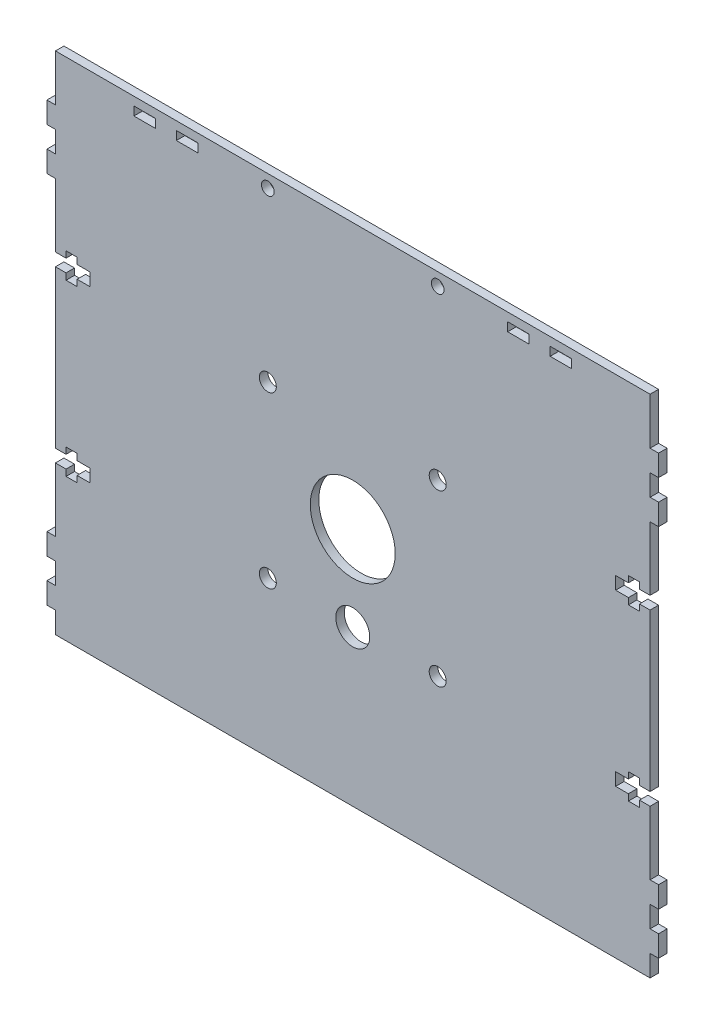
from build123d import *

# Parameters (mm, degrees)
SKETCH_1_R      = 10
SKETCH_1_R_2    = 4
SKETCH_1_R_3    = 1.5
SKETCH_1_R_4    = 2
SKETCH_1_W      = 5.05
SKETCH_1_H      = 2.05
EXTRUDE_1_DEPTH = 2


with BuildPart() as part:
    # 草图1 → 凸台-拉伸1 (new body)
    with BuildSketch(Plane.XY):
        Polygon((317.453360513, 257.462931603), (317.453360513, 258.962931602), (314.853360513, 258.962931602), (314.853360513, 257.462931603), (311.853360513, 257.462931603), (311.853360513, 254.462931603), (314.853360513, 254.462931603), (314.853360513, 252.962931603), (317.453360513, 252.962931603), (317.453360513, 254.462931603), (319.953360513, 254.462931603), (319.953360513, 239.462931603), (321.953360513, 239.462931603), (321.953360513, 234.462931603), (319.953360513, 234.462931603), (319.953360513, 229.462931603), (321.953360513, 229.462931603), (321.953360513, 224.462931603), (319.953360513, 224.462931603), (319.953360513, 219.440879401), (179.953360513, 219.440879401), (179.953360513, 224.462931603), (177.953360513, 224.462931603), (177.953360513, 229.462931603), (179.953360513, 229.462931603), (179.953360513, 234.462931603), (177.953360513, 234.462931603), (177.953360513, 239.462931603), (179.953360513, 239.462931603), (179.953360513, 254.462931603), (182.453360513, 254.462931603), (182.453360513, 252.962931603), (185.053360513, 252.962931603), (185.053360513, 254.462931603), (188.053360513, 254.462931603), (188.053360513, 257.462931603), (185.053360513, 257.462931603), (185.053360513, 258.962931602), (182.453360513, 258.962931602), (182.453360513, 257.462931603), (179.953360513, 257.462931603), (179.953360513, 294.462931603), (182.453360513, 294.462931603), (182.453360513, 292.962931603), (185.053360513, 292.962931603), (185.053360513, 294.462931603), (188.053360513, 294.462931603), (188.053360513, 297.462931603), (185.053360513, 297.462931603), (185.053360513, 298.962931603), (182.453360513, 298.962931603), (182.453360513, 297.462931603), (179.953360513, 297.462931603), (179.953360513, 312.462931603), (177.953360513, 312.462931603), (177.953360513, 317.462931603), (179.953360513, 317.462931603), (179.953360513, 322.462931603), (177.953360513, 322.462931603), (177.953360513, 327.462931603), (179.953360513, 327.462931603), (179.953360513, 338.472931603), (317.453360513, 338.472931603), (319.953360513, 338.472931603), (319.953360513, 330.982931603), (319.953360513, 327.462931603), (321.953360513, 327.462931603), (321.953360513, 322.462931603), (319.953360513, 322.462931603), (319.953360513, 317.462931603), (321.953360513, 317.462931603), (321.953360513, 312.462931603), (319.953360513, 312.462931603), (319.953360513, 297.462931603), (317.453360513, 297.462931603), (317.453360513, 298.962931603), (314.853360513, 298.962931603), (314.853360513, 297.462931603), (311.853360513, 297.462931603), (311.853360513, 294.462931603), (314.853360513, 294.462931603), (314.853360513, 292.962931603), (317.453360513, 292.962931603), (317.453360513, 294.462931603), (319.953360513, 294.462931603), (319.953360513, 257.462931603), align=None)
        with Locations((249.953360513, 275.962931603)):
            Circle(SKETCH_1_R, mode=Mode.SUBTRACT)
        with Locations((249.953360513, 255.962931603)):
            Circle(SKETCH_1_R_2, mode=Mode.SUBTRACT)
        with Locations((229.953360513, 335.462931603)):
            Circle(SKETCH_1_R_3, mode=Mode.SUBTRACT)
        with Locations((269.953360513, 335.462931603)):
            Circle(SKETCH_1_R_3, mode=Mode.SUBTRACT)
        with Locations((229.953360513, 255.962931603)):
            Circle(SKETCH_1_R_4, mode=Mode.SUBTRACT)
        with Locations((229.953360513, 295.962931603)):
            Circle(SKETCH_1_R_4, mode=Mode.SUBTRACT)
        with Locations((269.953360513, 295.962931603)):
            Circle(SKETCH_1_R_4, mode=Mode.SUBTRACT)
        with Locations((269.953360513, 255.962931603)):
            Circle(SKETCH_1_R_4, mode=Mode.SUBTRACT)
        with Locations((288.953360513, 335.462931603)):
            Rectangle(SKETCH_1_W, SKETCH_1_H, mode=Mode.SUBTRACT)
        with Locations((298.953360513, 335.462931603)):
            Rectangle(SKETCH_1_W, SKETCH_1_H, mode=Mode.SUBTRACT)
        with Locations((200.953360513, 335.462931603)):
            Rectangle(SKETCH_1_W, SKETCH_1_H, mode=Mode.SUBTRACT)
        with Locations((210.953360513, 335.462931603)):
            Rectangle(SKETCH_1_W, SKETCH_1_H, mode=Mode.SUBTRACT)
    extrude(amount=EXTRUDE_1_DEPTH)


solid = part.part
